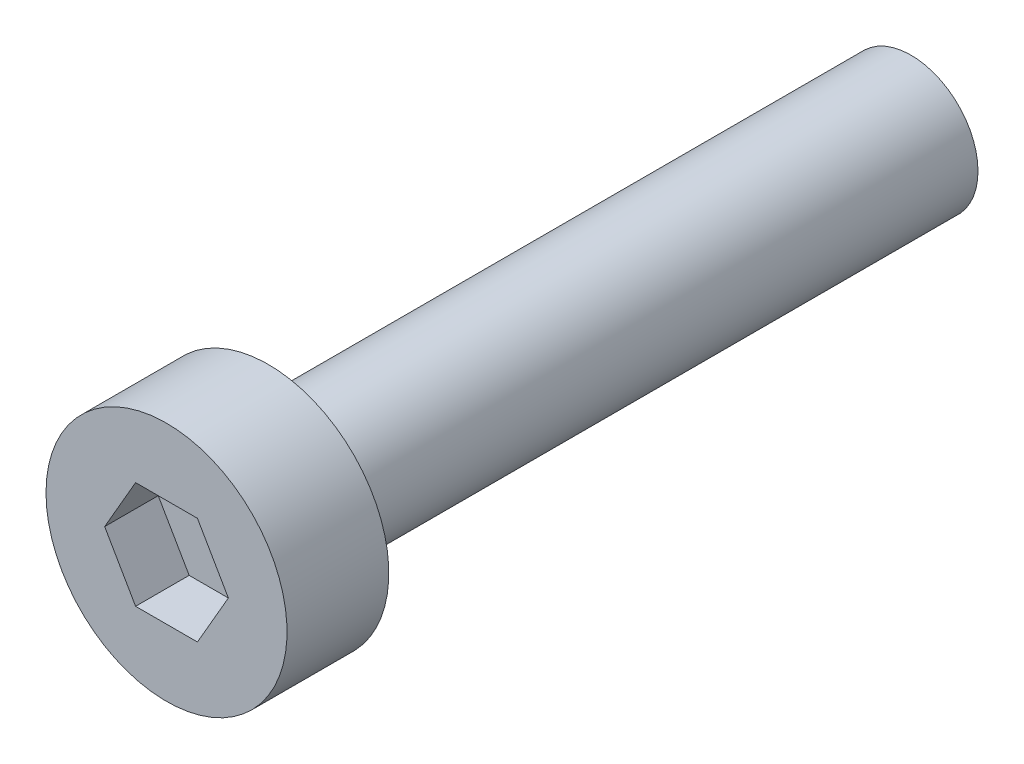
from build123d import *

# Parameters (mm, degrees)
ESQUISSE1_R             = 1.25
BOSS_EXTRU_1_DEPTH      = 12
ESQUISSE2_R             = 2.25
BOSS_EXTRU_2_DEPTH      = 1.9
ENL_V_MAT_EXTRU_1_DEPTH = 1


with BuildPart() as part:
    # Esquisse1 → Boss.-Extru.1 (new body)
    with BuildSketch(Plane.XY):
        Circle(ESQUISSE1_R)
    extrude(amount=BOSS_EXTRU_1_DEPTH)

    # Esquisse2 → Boss.-Extru.2 (add)
    with BuildSketch(Plane.XY.offset(12)):
        with Locations(Location((0, 0, 0), (0, 0, 180))):
            Circle(ESQUISSE2_R)
    extrude(amount=BOSS_EXTRU_2_DEPTH)

    # Esquisse3 → Enlèv. mat.-Extru.1 (cut)
    with BuildSketch(Plane.XY.offset(13.9)):
        Polygon((1.154700538, 0), (0.577350269, 1), (-0.577350269, 1), (-1.154700538, 0), (-0.577350269, -1), (0.577350269, -1), align=None)
    extrude(amount=-ENL_V_MAT_EXTRU_1_DEPTH, mode=Mode.SUBTRACT)


solid = part.part
